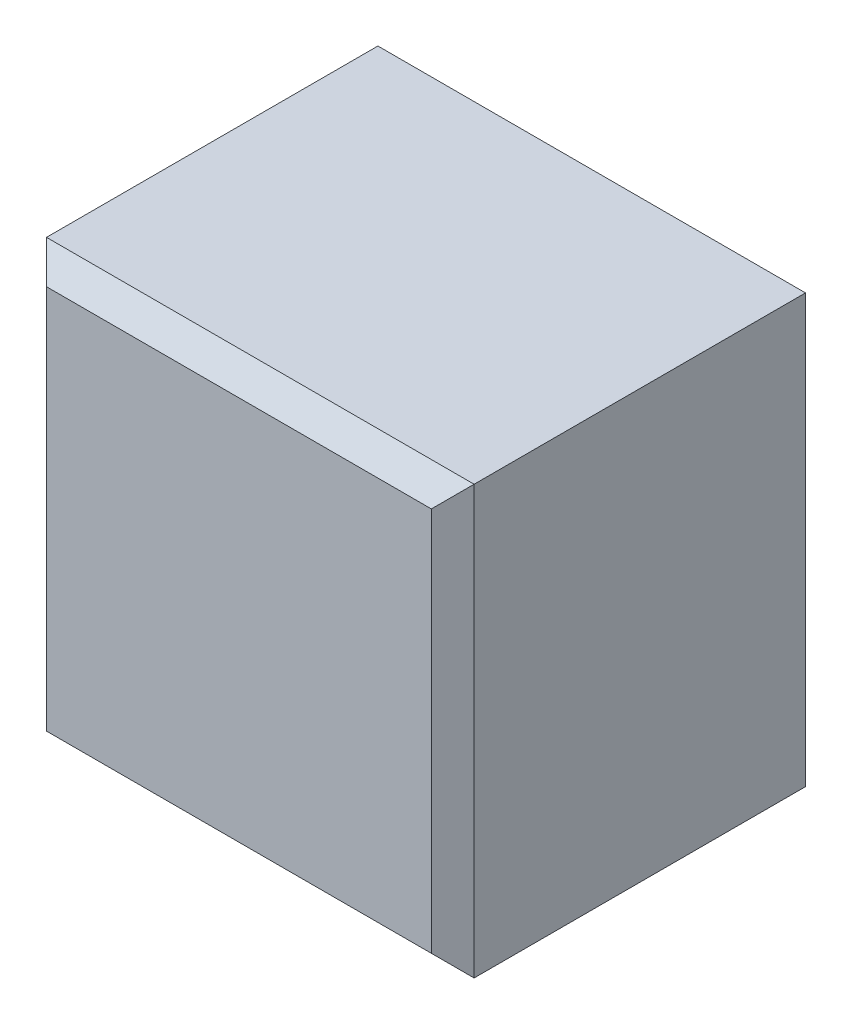
from build123d import *

# Parameters (mm, degrees)
BOSS_EXTRUDE1_DEPTH      = 10
BOSS_EXTRUDE1_DEPTH_BACK = 10
SKETCH1_W                = 20
SKETCH1_H                = 17.5
CHAMFER2_SIZE            = 1


with BuildPart() as part:
    # Sketch1 → Boss-Extrude1 (new, two sides: drawn at the far end of the back side and taken through both)
    with BuildSketch(Plane(origin=(0, 0, 0), x_dir=(1, 0, 0), z_dir=(0, 1, 0)).offset(-BOSS_EXTRUDE1_DEPTH_BACK)):
        Rectangle(SKETCH1_W, SKETCH1_H)
    extrude(amount=BOSS_EXTRUDE1_DEPTH + BOSS_EXTRUDE1_DEPTH_BACK)

    # Chamfer2
    chamfer2_edges = [part.edges().sort_by_distance(p)[0] for p in [
        (-10, 0, 8.75),
        (0, 10, 8.75),
        (10, 0, 8.75),
        (0, -10, 8.75),
        (10, 0, -8.75),
        (0, 10, -8.75),
        (-10, 0, -8.75),
        (0, -10, -8.75),
    ]]
    chamfer(chamfer2_edges, length=CHAMFER2_SIZE)


solid = part.part
